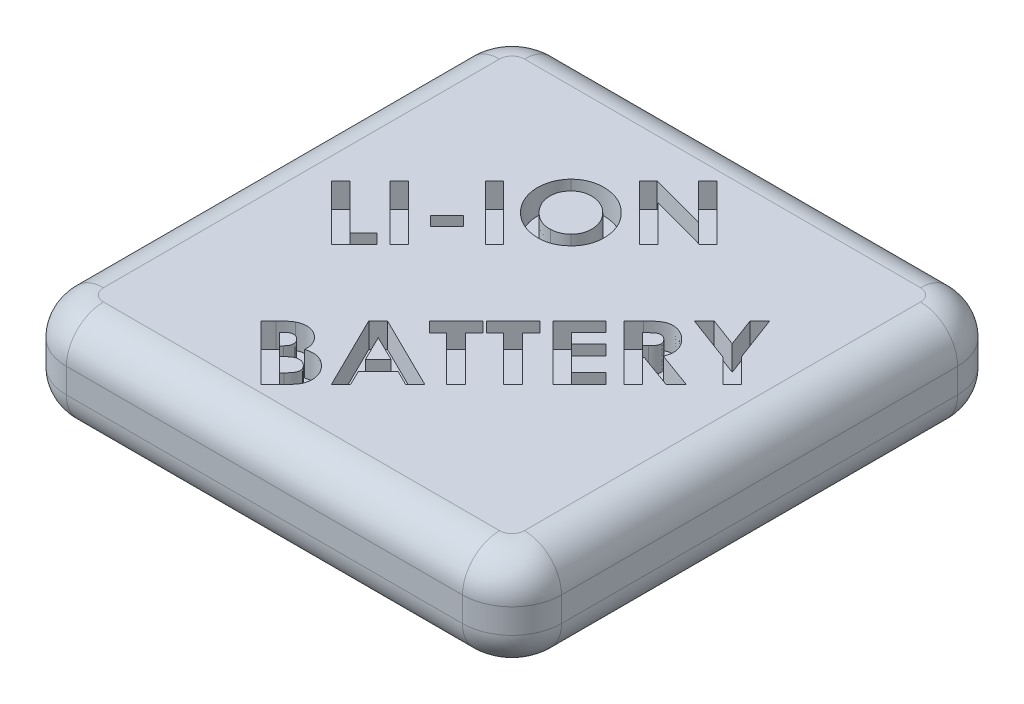
from build123d import *

# Parameters (mm, degrees)
BOSS_EXTRUDE1_DEPTH = 8
FILLET1_R           = 3
CUT_EXTRUDE2_DEPTH  = 2


with BuildPart() as part:
    # Sketch1 → Boss-Extrude1 (new body)
    with BuildSketch(Plane(origin=(0, 0, 0), x_dir=(1, 0, 0), z_dir=(0, 1, 0))):
        with BuildLine():
            Line((-16, -20), (16, -20))
            ThreePointArc((16, -20), (18.828427125, -18.828427125), (20, -16))
            Line((20, -16), (20, 16))
            ThreePointArc((20, 16), (18.828427125, 18.828427125), (16, 20))
            Line((16, 20), (-16, 20))
            ThreePointArc((-16, 20), (-18.828427125, 18.828427125), (-20, 16))
            Line((-20, 16), (-20, -16))
            ThreePointArc((-20, -16), (-18.828427125, -18.828427125), (-16, -20))
        make_face()
    extrude(amount=BOSS_EXTRUDE1_DEPTH)

    # Fillet1
    fillet1_edges = [part.edges().sort_by_distance(p)[0] for p in [
        (20, 0, 0),
        (18.828427125, 0, 18.828427125),
        (0, 0, 20),
        (-18.828427125, 0, 18.828427125),
        (18.828427125, 8, 18.828427125),
        (20, 8, 0),
        (18.828427125, 8, -18.828427125),
        (0, 8, -20),
        (-18.828427125, 8, -18.828427125),
        (-20, 8, 0),
        (-18.828427125, 8, 18.828427125),
        (-20, 0, 0),
        (0, 8, 20),
        (-18.828427125, 0, -18.828427125),
        (0, 0, -20),
        (18.828427125, 0, -18.828427125),
    ]]
    fillet(fillet1_edges, radius=FILLET1_R)

    # Sketch2 → Cut-Extrude2 (cut)
    # profile 1 of 13: a face of its own
    with BuildSketch(Plane(origin=(0, 8, 0), x_dir=(1, 0, 0), z_dir=(0, 1, 0))):
        Polygon((-15.274861299, 0.685188885), (-14.529448639, 1.430601545), (-10.891427805, -2.207419288), (-9.805109696, -1.121101179), (-8.998639344, -1.927571532), (-10.830370113, -3.759302301), align=None)
    # profile 2 of 13: a face of its own
    with BuildSketch(Plane(origin=(0, 8, 0), x_dir=(1, 0, 0), z_dir=(0, 1, 0))):
        Polygon((-12.910525516, 3.049524667), (-12.170200997, 3.789849187), (-7.725709811, -0.654641999), (-8.46603433, -1.394966518), align=None)
    # profile 3 of 13: a face of its own
    with BuildSketch(Plane(origin=(0, 8, 0), x_dir=(1, 0, 0), z_dir=(0, 1, 0))):
        Polygon((-8.857973175, 2.255622682), (-7.505799697, 3.60779616), (-6.738762438, 2.8407589), (-8.090935915, 1.488585422), align=None)
    # profile 4 of 13: a face of its own
    with BuildSketch(Plane(origin=(0, 8, 0), x_dir=(1, 0, 0), z_dir=(0, 1, 0))):
        Polygon((-9.053620644, 6.90642954), (-8.313296124, 7.646754059), (-3.868804939, 3.202262873), (-4.609129458, 2.461938354), align=None)
    # profile 5 of 13: a face of its own
    with BuildSketch(Plane(origin=(0, 8, 0), x_dir=(1, 0, 0), z_dir=(0, 1, 0))):
        with BuildLine():
            add(Edge.make_bspline(
                [(-5.70704787, 10.476880519), (-5.636789535, 10.542978717), (-5.497899762, 10.673644547), (-5.26693472, 10.839233045), (-5.022670111, 10.976693742), (-4.763649211, 11.083849402), (-4.49104985, 11.162895674), (-4.20455635, 11.213901155), (-3.904035101, 11.234992986), (-3.593690293, 11.226559394), (-3.280658401, 11.19185541), (-2.973382826, 11.127744292), (-2.674772779, 11.037639381), (-2.386397287, 10.91687413), (-2.106834299, 10.76907204), (-1.837633966, 10.59186761), (-1.576506233, 10.388316912), (-1.414761915, 10.233683274), (-1.332518623, 10.155055599)],
                knots=[0, 0, 0, 0, 0.949660491, 1.877330707, 2.792020575, 3.706042262, 4.632893584, 5.58357368, 6.567973248, 7.596070976, 8.638802124, 9.667146016, 10.684816849, 11.707466942, 12.742881944, 13.79624766, 14.879442259, 16, 16, 16, 16], degree=3))
            add(Edge.make_bspline(
                [(-1.332518623, 10.155055599), (-1.254844404, 10.073578559), (-1.101927393, 9.913174943), (-0.899251036, 9.655511675), (-0.725453726, 9.38818451), (-0.578167433, 9.112746992), (-0.458843272, 8.82749259), (-0.36915912, 8.532803353), (-0.304147907, 8.22954771), (-0.271163774, 7.92051761), (-0.264486752, 7.613657697), (-0.284625995, 7.315920993), (-0.337762236, 7.031710076), (-0.417585891, 6.760065498), (-0.527779983, 6.5020625), (-0.666270956, 6.256835287), (-0.834754361, 6.025182436), (-0.966720461, 5.884756112), (-1.033590337, 5.813599269)],
                knots=[0, 0, 0, 0, 1.115855153, 2.196780853, 3.245258744, 4.27419606, 5.290138263, 6.306289278, 7.324760444, 8.361171015, 9.383151457, 10.36547195, 11.314721521, 12.244664983, 13.167805717, 14.090419612, 15.032377223, 16, 16, 16, 16], degree=3))
            add(Edge.make_bspline(
                [(-1.033590337, 5.813599269), (-1.107596112, 5.74361614), (-1.253329491, 5.605804221), (-1.494208969, 5.431471806), (-1.746591201, 5.287371913), (-2.011721867, 5.174696797), (-2.289611526, 5.093051401), (-2.579710216, 5.041905959), (-2.882114292, 5.023683236), (-3.192615753, 5.035442344), (-3.503591369, 5.076336274), (-3.808786584, 5.141959746), (-4.102782113, 5.236654586), (-4.386859438, 5.357226012), (-4.661501193, 5.502370307), (-4.925393542, 5.675376136), (-5.18020787, 5.873814479), (-5.337315257, 6.024585449), (-5.417023831, 6.101079237)],
                knots=[0, 0, 0, 0, 0.999101073, 1.967446131, 2.910773087, 3.847093627, 4.788876284, 5.748376674, 6.732765781, 7.757485035, 8.794274862, 9.808378589, 10.818107044, 11.821664258, 12.834682353, 13.863426832, 14.916007676, 16, 16, 16, 16], degree=3))
            add(Edge.make_bspline(
                [(-5.417023831, 6.101079237), (-5.469093378, 6.154232537), (-5.572357864, 6.259646327), (-5.712446372, 6.428540797), (-5.843547886, 6.600475684), (-5.961566504, 6.778812924), (-6.068709391, 6.962219912), (-6.16451992, 7.151129948), (-6.248424672, 7.345207176), (-6.319158773, 7.543931914), (-6.379384882, 7.744062537), (-6.425340347, 7.945497333), (-6.456896783, 8.146588763), (-6.47606071, 8.346658811), (-6.482965428, 8.545958298), (-6.47471266, 8.744803274), (-6.454893201, 8.943354351), (-6.420305226, 9.140054253), (-6.373424448, 9.332484521), (-6.315346376, 9.519013167), (-6.243271415, 9.697550122), (-6.161248495, 9.869278136), (-6.066144184, 10.033258243), (-5.959719613, 10.189848759), (-5.839345458, 10.338056023), (-5.751353976, 10.430388569), (-5.70704787, 10.476880519)],
                knots=[0, 0, 0, 0, 1.099560303, 2.180651401, 3.241267936, 4.294822041, 5.339819429, 6.379860577, 7.424350233, 8.463314098, 9.496608553, 10.512395587, 11.515120861, 12.503737963, 13.482107362, 14.460697622, 15.443694706, 16.429924225, 17.410540077, 18.370073228, 19.315248464, 20.254460127, 21.181248087, 22.114900063, 23.05080087, 24, 24, 24, 24], degree=3))
        make_face()
        with BuildLine():
            add(Edge.make_bspline(
                [(-4.886585129, 9.641153356), (-4.92954069, 9.595354217), (-5.014238245, 9.505049842), (-5.123068525, 9.35636115), (-5.212127484, 9.199495404), (-5.283522914, 9.034694536), (-5.333905589, 8.86152839), (-5.365646429, 8.68022759), (-5.379664104, 8.491452076), (-5.37412602, 8.296354922), (-5.350540564, 8.099442647), (-5.306647348, 7.905401463), (-5.245511355, 7.715046457), (-5.163373125, 7.529883514), (-5.064091878, 7.348082959), (-4.944270102, 7.172565185), (-4.808340673, 6.999057502), (-4.70442105, 6.891393554), (-4.651258607, 6.836315615)],
                knots=[0, 0, 0, 0, 0.958996566, 1.89089986, 2.807995678, 3.710785511, 4.629413959, 5.557366053, 6.519073631, 7.517353353, 8.535727066, 9.545050782, 10.553292202, 11.586302148, 12.636166496, 13.71454217, 14.830822124, 16, 16, 16, 16], degree=3))
            add(Edge.make_bspline(
                [(-4.651258607, 6.836315615), (-4.589927619, 6.777933896), (-4.47032748, 6.664085059), (-4.277612711, 6.515729626), (-4.080772643, 6.38987176), (-3.877371661, 6.29046072), (-3.669889208, 6.214109758), (-3.456822613, 6.163684267), (-3.238891746, 6.133667879), (-3.091834173, 6.135683668), (-3.017965337, 6.136696224)],
                knots=[0, 0, 0, 0, 1.10936509, 2.163347156, 3.182652996, 4.167049769, 5.125365169, 6.074464148, 7.032779548, 8, 8, 8, 8], degree=3))
            add(Edge.make_bspline(
                [(-3.017965337, 6.136696224), (-2.961026465, 6.140281485), (-2.8486683, 6.147356323), (-2.684582366, 6.176460863), (-2.526832553, 6.216015347), (-2.377585983, 6.273383195), (-2.234248677, 6.341446896), (-2.099407255, 6.425089449), (-1.970166111, 6.520578283), (-1.892299797, 6.595012884), (-1.852781043, 6.632789974)],
                knots=[0, 0, 0, 0, 1.054612827, 2.081080226, 3.077991407, 4.05847399, 5.033765885, 6.009089322, 6.989571905, 8, 8, 8, 8], degree=3))
            add(Edge.make_bspline(
                [(-1.852781043, 6.632789974), (-1.810568565, 6.677667508), (-1.727521223, 6.765957987), (-1.622805632, 6.91295849), (-1.535324082, 7.067960202), (-1.466490856, 7.231759922), (-1.417937778, 7.404912903), (-1.387758153, 7.586156269), (-1.374888561, 7.77620773), (-1.382187562, 7.972455947), (-1.40505866, 8.170301056), (-1.449525283, 8.364531294), (-1.509093338, 8.554388035), (-1.587902047, 8.738480017), (-1.686046821, 8.916711807), (-1.800889152, 9.089834052), (-1.932898023, 9.258614059), (-2.033306379, 9.362998878), (-2.084291459, 9.416003115)],
                knots=[0, 0, 0, 0, 0.951224188, 1.871404966, 2.780908117, 3.697278026, 4.609962298, 5.553640835, 6.532188241, 7.548383682, 8.584662324, 9.605284734, 10.622810287, 11.656163663, 12.694243144, 13.762874379, 14.864038488, 16, 16, 16, 16], degree=3))
            add(Edge.make_bspline(
                [(-2.084291459, 9.416003115), (-2.137274956, 9.467013763), (-2.24118974, 9.567059261), (-2.409734269, 9.698405429), (-2.582565161, 9.813236459), (-2.761230024, 9.911228739), (-2.946827497, 9.988082169), (-3.136946841, 10.050702231), (-3.333768206, 10.091487108), (-3.533208297, 10.11764352), (-3.730843319, 10.123523584), (-3.922221443, 10.112907408), (-4.105212201, 10.082191783), (-4.279999971, 10.032987388), (-4.445874221, 9.963248006), (-4.602960416, 9.875052334), (-4.751625173, 9.767948442), (-4.841252345, 9.683743576), (-4.886585129, 9.641153356)],
                knots=[0, 0, 0, 0, 1.128697689, 2.213677507, 3.275475456, 4.312634366, 5.336837793, 6.356041685, 7.381465349, 8.418379001, 9.44109135, 10.412967233, 11.357031853, 12.284448193, 13.19495844, 14.113187666, 15.045663797, 16, 16, 16, 16], degree=3))
        make_face(mode=Mode.SUBTRACT)
    # profile 6 of 13: a face of its own
    with BuildSketch(Plane(origin=(0, 8, 0), x_dir=(1, 0, 0), z_dir=(0, 1, 0))):
        Polygon((-2.838116445, 13.121933738), (-2.124504666, 13.835545517), (2.480262962, 12.591495036), (-0.444146093, 15.515904091), (0.301266568, 16.261316751), (4.745757753, 11.816825565), (4.029601904, 11.100669716), (-0.563717407, 12.33836002), (2.351787401, 9.422855213), (1.606374741, 8.677442553), align=None)
    # profile 7 of 13: a face of its own
    with BuildSketch(Plane(origin=(0, 8, 0), x_dir=(1, 0, 0), z_dir=(0, 1, 0))):
        with BuildLine():
            Line((-3.877380068, -16.411301038), (-8.321871254, -11.966809852))
            Line((-8.321871254, -11.966809852), (-7.707478225, -11.352416823))
            add(Edge.make_bspline(
                [(-7.707478225, -11.352416823), (-7.663894703, -11.309504412), (-7.579920142, -11.226822916), (-7.457041327, -11.108663183), (-7.3379635, -11.005249098), (-7.227857227, -10.910315987), (-7.123428295, -10.827632406), (-7.025985855, -10.755876397), (-6.93387904, -10.69692584), (-6.873611481, -10.663538433), (-6.845038321, -10.647709291)],
                knots=[0, 0, 0, 0, 1.31371916, 2.531208653, 3.660343491, 4.700475678, 5.653389709, 6.520452199, 7.298538777, 8, 8, 8, 8], degree=3))
            add(Edge.make_bspline(
                [(-6.845038321, -10.647709291), (-6.807120059, -10.628541133), (-6.732019881, -10.590577048), (-6.616278416, -10.543152006), (-6.498240716, -10.5072411), (-6.379328755, -10.482718145), (-6.259615722, -10.464663952), (-6.138649369, -10.460918054), (-6.016060431, -10.463603808), (-5.893301333, -10.479917439), (-5.771423725, -10.503233917), (-5.652276886, -10.53797222), (-5.536520385, -10.583042978), (-5.423123678, -10.635702677), (-5.314184883, -10.700361423), (-5.20889041, -10.7746022), (-5.105002057, -10.856753477), (-5.040782661, -10.918927543), (-5.008219411, -10.950453682)],
                knots=[0, 0, 0, 0, 1.017937308, 2.016106961, 2.993264565, 3.969787994, 4.923957983, 5.890117731, 6.866059471, 7.859199746, 8.853586772, 9.837588406, 10.828282583, 11.82826075, 12.830301793, 13.85918525, 14.91447304, 16, 16, 16, 16], degree=3))
            add(Edge.make_bspline(
                [(-5.008219411, -10.950453682), (-4.967699778, -10.992783328), (-4.888310378, -11.075719055), (-4.789625644, -11.21372813), (-4.705148461, -11.355509427), (-4.639931509, -11.505562222), (-4.592646992, -11.66444549), (-4.561328066, -11.833212868), (-4.552255729, -12.01389267), (-4.558511866, -12.137289923), (-4.561735036, -12.200864339)],
                knots=[0, 0, 0, 0, 1.021870414, 2.002132618, 2.954403821, 3.899279528, 4.850168457, 5.84339975, 6.888916902, 8, 8, 8, 8], degree=3))
            add(Edge.make_bspline(
                [(-4.561735036, -12.200864339), (-4.51693291, -12.188009536), (-4.428793838, -12.162720324), (-4.296170038, -12.134947802), (-4.166613967, -12.115654811), (-4.039989646, -12.105445281), (-3.91663373, -12.103445319), (-3.796417758, -12.113245503), (-3.678952042, -12.129200676), (-3.526047232, -12.163429525), (-3.33842782, -12.228351249), (-3.12278791, -12.340466937), (-2.913893568, -12.485298287), (-2.788303963, -12.604028762), (-2.72364409, -12.665157208)],
                knots=[0, 0, 0, 0, 0.836633825, 1.645906931, 2.43078481, 3.186928672, 3.925429008, 4.643032597, 5.350386504, 6.052270514, 7.453476384, 8.900547473, 10.404245258, 12, 12, 12, 12], degree=3))
            add(Edge.make_bspline(
                [(-2.72364409, -12.665157208), (-2.664261298, -12.728602219), (-2.547746906, -12.853087051), (-2.404234865, -13.062363714), (-2.289913607, -13.283707716), (-2.207093716, -13.515394474), (-2.152705223, -13.749369892), (-2.132503524, -13.98008942), (-2.141449012, -14.204224979), (-2.178210442, -14.38532938), (-2.224149454, -14.527454556), (-2.270125485, -14.635567573), (-2.328001468, -14.744757642), (-2.395677234, -14.856557396), (-2.476192964, -14.968800409), (-2.566588973, -15.083782894), (-2.668913056, -15.199748624), (-2.742816262, -15.275688231), (-2.780885677, -15.314806647)],
                knots=[0, 0, 0, 0, 1.387950803, 2.723284608, 4.042373587, 5.361375438, 6.647627369, 7.872871536, 9.053868927, 10.222678156, 10.814459997, 11.440333308, 12.098429915, 12.789143477, 13.528462835, 14.305703219, 15.127224786, 16, 16, 16, 16], degree=3))
            Line((-2.780885677, -15.314806647), (-3.877380068, -16.411301038))
        make_face()
        with BuildLine():
            Line((-6.769988241, -12.027867545), (-5.832498257, -12.965357528))
            Line((-5.832498257, -12.965357528), (-5.669677744, -12.802537016))
            add(Edge.make_bspline(
                [(-5.669677744, -12.802537016), (-5.628820545, -12.758776497), (-5.551874939, -12.676363126), (-5.463937988, -12.54114185), (-5.410920523, -12.405434197), (-5.392244203, -12.27026134), (-5.405433233, -12.138897545), (-5.447753223, -12.0118769), (-5.518900583, -11.890918238), (-5.583870847, -11.820244517), (-5.617524299, -11.783636775)],
                knots=[0, 0, 0, 0, 1.236355121, 2.32840463, 3.313540489, 4.224906483, 5.123488641, 6.019028742, 6.973891791, 8, 8, 8, 8], degree=3))
            add(Edge.make_bspline(
                [(-5.617524299, -11.783636775), (-5.652017457, -11.751664426), (-5.718221437, -11.690298727), (-5.832323428, -11.624394152), (-5.951316048, -11.584218834), (-6.07523594, -11.573166532), (-6.203182868, -11.588962027), (-6.330116792, -11.642914942), (-6.459027479, -11.723600345), (-6.536735916, -11.796933519), (-6.577910917, -11.835790221)],
                knots=[0, 0, 0, 0, 1.028782677, 1.97458022, 2.865580678, 3.76219227, 4.681470305, 5.66227592, 6.761321218, 8, 8, 8, 8], degree=3))
            Line((-6.577910917, -11.835790221), (-6.769988241, -12.027867545))
        make_face(mode=Mode.SUBTRACT)
        with BuildLine():
            Line((-5.07818135, -13.719674436), (-3.93843776, -14.859418025))
            Line((-3.93843776, -14.859418025), (-3.751448578, -14.672428843))
            add(Edge.make_bspline(
                [(-3.751448578, -14.672428843), (-3.714608755, -14.635045759), (-3.644026046, -14.563422197), (-3.548858309, -14.455270795), (-3.466439524, -14.352930153), (-3.397429151, -14.256186372), (-3.343966458, -14.163125002), (-3.300289962, -14.07745876), (-3.27340936, -13.994927433), (-3.254242351, -13.893646668), (-3.258656247, -13.770016014), (-3.297989025, -13.626362149), (-3.37568242, -13.48912333), (-3.448648688, -13.409187552), (-3.486865244, -13.36732067)],
                knots=[0, 0, 0, 0, 1.234802609, 2.365801674, 3.387970409, 4.326309049, 5.157959039, 5.912083094, 6.584123015, 7.192735023, 8.330534842, 9.458493286, 10.668869351, 12, 12, 12, 12], degree=3))
            add(Edge.make_bspline(
                [(-3.486865244, -13.36732067), (-3.510615162, -13.34477885), (-3.557205931, -13.300558037), (-3.632761293, -13.243953636), (-3.708943855, -13.193802618), (-3.789802272, -13.157816173), (-3.871463318, -13.129430692), (-3.955348279, -13.109667969), (-4.041698467, -13.101003433), (-4.130401615, -13.102612904), (-4.221761633, -13.113320132), (-4.315059993, -13.139962015), (-4.410841503, -13.178548921), (-4.509391817, -13.229859728), (-4.609678197, -13.295419358), (-4.712791312, -13.373845845), (-4.819733197, -13.463466258), (-4.888670568, -13.530926396), (-4.924265084, -13.56575817)],
                knots=[0, 0, 0, 0, 0.948789672, 1.861262858, 2.734615315, 3.58746903, 4.41968251, 5.240000079, 6.080620426, 6.929208068, 7.809287344, 8.74005529, 9.733382348, 10.80039767, 11.956715607, 13.203641971, 14.556153101, 16, 16, 16, 16], degree=3))
            Line((-4.924265084, -13.56575817), (-5.07818135, -13.719674436))
        make_face(mode=Mode.SUBTRACT)
    # profile 8 of 13: a face of its own
    with BuildSketch(Plane(origin=(0, 8, 0), x_dir=(1, 0, 0), z_dir=(0, 1, 0))):
        Polygon((-3.962586243, -7.607524842), (-3.206997301, -6.851935899), (2.744855664, -9.789065306), (1.970186193, -10.563734777), (0.747760311, -9.95442989), (-0.849915971, -11.552106172), (-0.253331436, -12.787252406), (-1.028000907, -13.561921877), align=None)
        Polygon((-2.400526948, -8.403818912), (-1.396891131, -10.45052364), (-0.355094256, -9.408726765), align=None, mode=Mode.SUBTRACT)
    # profile 9 of 13: a face of its own
    with BuildSketch(Plane(origin=(0, 8, 0), x_dir=(1, 0, 0), z_dir=(0, 1, 0))):
        Polygon((-1.512851926, -5.157790524), (0.65215208, -2.992786518), (1.486607208, -3.827241646), (0.77299543, -4.540853425), (4.383031487, -8.150889483), (3.627442545, -8.906478425), (0.017406487, -5.296442367), (-0.678396798, -5.992245653), align=None)
    # profile 10 of 13: a face of its own
    with BuildSketch(Plane(origin=(0, 8, 0), x_dir=(1, 0, 0), z_dir=(0, 1, 0))):
        Polygon((0.789777849, -2.85516075), (2.954781855, -0.690156743), (3.789236983, -1.524611872), (3.075625204, -2.23822365), (6.685661262, -5.848259708), (5.93007232, -6.60384865), (2.320036262, -2.993812593), (1.624232977, -3.689615878), align=None)
    # profile 11 of 13: a face of its own
    with BuildSketch(Plane(origin=(0, 8, 0), x_dir=(1, 0, 0), z_dir=(0, 1, 0))):
        Polygon((3.481650412, -0.163288187), (5.619941678, 1.975003079), (6.44803663, 1.146908127), (5.050069883, -0.251058619), (5.853996165, -1.054984901), (7.251962912, 0.342981845), (8.06479344, -0.469848684), (6.666826694, -1.86781543), (7.835827094, -3.036815831), (9.233793841, -1.638849084), (10.064432864, -2.469488107), (7.926141598, -4.607779373), align=None)
    # profile 12 of 13: a face of its own
    with BuildSketch(Plane(origin=(0, 8, 0), x_dir=(1, 0, 0), z_dir=(0, 1, 0))):
        with BuildLine():
            Line((6.350709225, 2.705770627), (7.14064312, 3.495704521))
            add(Edge.make_bspline(
                [(7.14064312, 3.495704521), (7.1932968, 3.547795223), (7.294597017, 3.648012326), (7.445922019, 3.78644911), (7.589364119, 3.909388179), (7.723937647, 4.018006969), (7.853660122, 4.108232568), (7.973684921, 4.185451152), (8.0870335, 4.246138368), (8.228490422, 4.30389203), (8.4057749, 4.350392408), (8.624957669, 4.368856001), (8.851648366, 4.353474624), (9.082959585, 4.299629852), (9.315712434, 4.213567721), (9.543163469, 4.090895342), (9.764527483, 3.934986013), (9.898260657, 3.807901489), (9.967105459, 3.742479361)],
                knots=[0, 0, 0, 0, 1.082735302, 2.083070333, 2.997473572, 3.844558565, 4.609854293, 5.306358917, 5.930256112, 6.486251686, 7.537219624, 8.595111488, 9.688634948, 10.84509099, 12.055256797, 13.305957885, 14.613127996, 16, 16, 16, 16], degree=3))
            add(Edge.make_bspline(
                [(9.967105459, 3.742479361), (10.002246473, 3.705936), (10.070959288, 3.634481114), (10.165950511, 3.523313949), (10.249775958, 3.410058905), (10.324012065, 3.295479652), (10.387313165, 3.17965747), (10.442203865, 3.063410962), (10.483148905, 2.944431764), (10.517516023, 2.825007945), (10.538096528, 2.703373733), (10.551916552, 2.581048293), (10.552510481, 2.457128153), (10.543683255, 2.332085451), (10.524333381, 2.20580109), (10.494984961, 2.077707329), (10.45422616, 1.948694844), (10.420470832, 1.863489931), (10.403413552, 1.820434089)],
                knots=[0, 0, 0, 0, 1.152991912, 2.254497248, 3.32308623, 4.355687494, 5.357056366, 6.323640216, 7.275338856, 8.215929132, 9.146678352, 10.077527496, 11.013061065, 11.96059706, 12.926266336, 13.915862782, 14.94684145, 16, 16, 16, 16], degree=3))
            Line((10.403413552, 1.820434089), (13.306198007, 0.772277037))
            Line((13.306198007, 0.772277037), (12.490823408, -0.043097562))
            Line((12.490823408, -0.043097562), (9.726690796, 0.957994185))
            Line((9.726690796, 0.957994185), (9.658000892, 0.889304281))
            Line((9.658000892, 0.889304281), (11.540613071, -0.993307899))
            Line((11.540613071, -0.993307899), (10.795200411, -1.738720559))
            Line((10.795200411, -1.738720559), (6.350709225, 2.705770627))
        make_face()
        with BuildLine():
            Line((8.833722046, 1.713583127), (9.067776533, 1.947637614))
            add(Edge.make_bspline(
                [(9.067776533, 1.947637614), (9.096022221, 1.976649568), (9.150259617, 2.03235835), (9.224137625, 2.116401994), (9.288043799, 2.196475326), (9.341894926, 2.272775625), (9.385329082, 2.345423015), (9.419825805, 2.414241898), (9.440762231, 2.480596456), (9.459258971, 2.563009813), (9.45600953, 2.668032361), (9.416370646, 2.792567289), (9.342847977, 2.916834205), (9.273778973, 2.990739542), (9.236957222, 3.030139617)],
                knots=[0, 0, 0, 0, 1.146423861, 2.201364176, 3.167054355, 4.046408113, 4.843286771, 5.562880555, 6.219740225, 6.808429971, 7.949307604, 9.141893845, 10.476299522, 12, 12, 12, 12], degree=3))
            add(Edge.make_bspline(
                [(9.236957222, 3.030139617), (9.213043317, 3.053024635), (9.166310558, 3.097746734), (9.086337349, 3.149301609), (9.004164148, 3.189968438), (8.919068784, 3.21617312), (8.833479405, 3.230995631), (8.748399071, 3.230670825), (8.665263422, 3.217820049), (8.579587656, 3.191452368), (8.488285702, 3.139674258), (8.382471962, 3.063620341), (8.260973417, 2.956040565), (8.17569526, 2.873220961), (8.129014514, 2.827886012)],
                knots=[0, 0, 0, 0, 0.91659215, 1.791212321, 2.627970227, 3.454154279, 4.25307523, 5.029675046, 5.803506544, 6.581264335, 7.502527241, 8.70076424, 10.194018328, 12, 12, 12, 12], degree=3))
            Line((8.129014514, 2.827886012), (7.924216837, 2.623088335))
            Line((7.924216837, 2.623088335), (8.833722046, 1.713583127))
        make_face(mode=Mode.SUBTRACT)
    # profile 13 of 13: a face of its own
    with BuildSketch(Plane(origin=(0, 8, 0), x_dir=(1, 0, 0), z_dir=(0, 1, 0))):
        Polygon((9.186095999, 5.5411574), (9.98747821, 6.342539612), (12.312758659, 5.477555638), (11.441414508, 7.79647591), (12.232620438, 8.58768184), (13.60769055, 4.922948266), (15.532279893, 2.998358923), (14.780507056, 2.246586086), (12.855917713, 4.171175429), align=None)
    extrude(amount=-CUT_EXTRUDE2_DEPTH, mode=Mode.SUBTRACT)


solid = part.part
